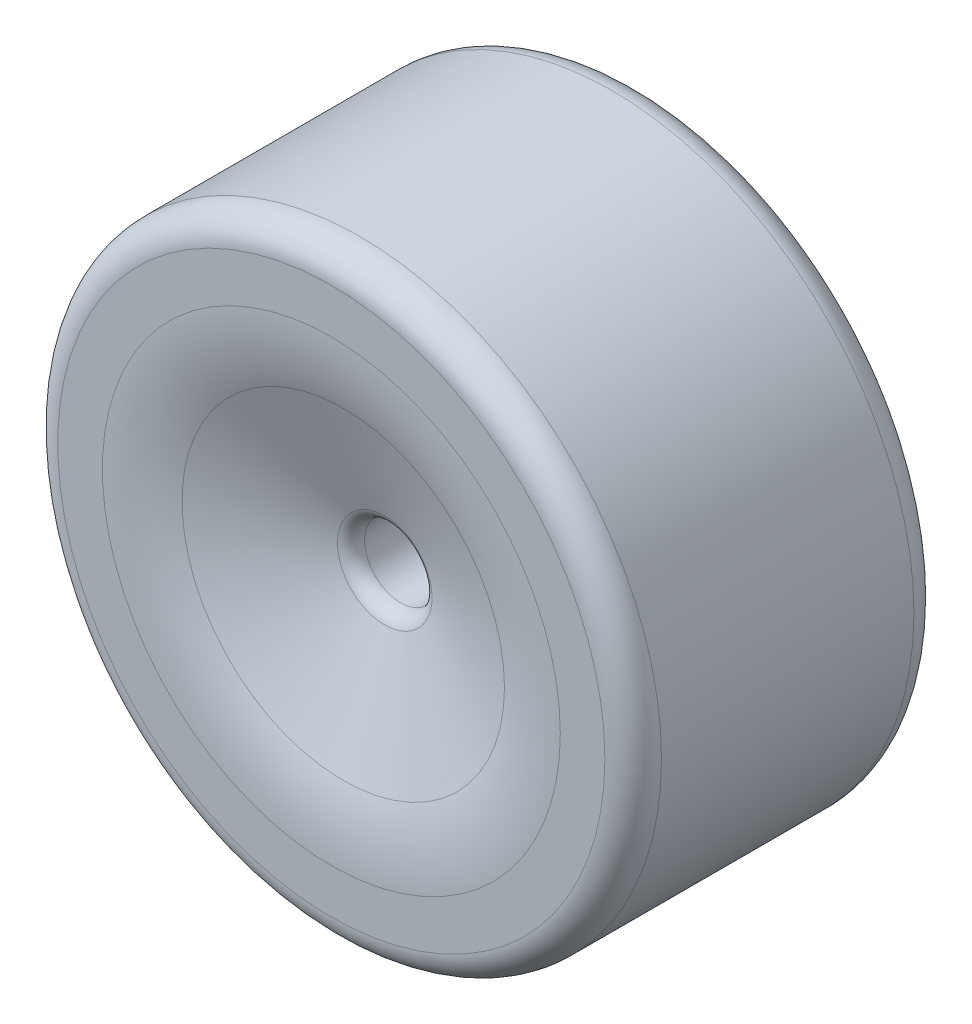
from build123d import *

# Parameters (mm, degrees)
SKETCH1_R          = 53.34
EXTRUDE1_DEPTH     = 54.61
FILLET1_R          = 5
SKETCH2_R          = 27.432
CUT_EXTRUDE1_DEPTH = 17.78
FILLET2_R          = 2
SKETCH3_R          = 34.29
CUT_EXTRUDE2_DEPTH = 10.16
CUT_EXTRUDE2_DRAFT = -70
FILLET3_R          = 35
SKETCH4_R          = 6.375629418
CUT_EXTRUDE3_DEPTH = 15.24
FILLET4_R          = 3


with BuildPart() as part:
    # Sketch1 → Extrude1 (new body)
    with BuildSketch(Plane.XY):
        Circle(SKETCH1_R)
    extrude(amount=EXTRUDE1_DEPTH)

    # Fillet1
    fillet1_edges = [part.edges().sort_by_distance(p)[0] for p in [
        (-53.34, 0, 0),
        (-53.34, 0, 54.61),
    ]]
    fillet(fillet1_edges, radius=FILLET1_R)

    # Sketch2 → Cut-Extrude1 (cut)
    with BuildSketch(Plane(origin=(0, 0, 0), x_dir=(-1, 0, 0), z_dir=(0, 0, -1))):
        Circle(SKETCH2_R)
    extrude(amount=-CUT_EXTRUDE1_DEPTH, mode=Mode.SUBTRACT)

    # Fillet2
    fillet2_edges = [part.edges().sort_by_distance(p)[0] for p in [
        (27.432, 0, 0),
    ]]
    fillet(fillet2_edges, radius=FILLET2_R)


with BuildPart() as cut_extrude2_tool:
    # Sketch3 → Cut-Extrude2 (with draft: the straight prism first)
    with BuildSketch(Plane.XY.offset(54.61)):
        Circle(SKETCH3_R)
    extrude(amount=-CUT_EXTRUDE2_DEPTH)
    # Cut-Extrude2: the draft: its side faces are tilted about the plane it starts from
    cut_extrude2_sides = [cut_extrude2_tool.faces().sort_by_distance(p)[0] for p in [
        (-34.29, 0, 49.53),
    ]]
    draft(cut_extrude2_sides, Plane.XY.offset(54.61), CUT_EXTRUDE2_DRAFT)


with BuildPart() as part_1:
    add(part.part)

    # Cut-Extrude2: cut by cut_extrude2_tool
    add(cut_extrude2_tool.part, mode=Mode.SUBTRACT)

    # Fillet3
    fillet3_edges = [part_1.edges().sort_by_distance(p)[0] for p in [
        (-34.29, 0, 54.61),
    ]]
    fillet(fillet3_edges, radius=FILLET3_R)

    # Sketch4 → Cut-Extrude3 (cut)
    with BuildSketch(Plane.XY.offset(44.45)):
        Circle(SKETCH4_R)
    extrude(amount=-CUT_EXTRUDE3_DEPTH, mode=Mode.SUBTRACT)

    # Fillet4
    fillet4_edges = [part_1.edges().sort_by_distance(p)[0] for p in [
        (-6.375629418, 0, 44.45),
    ]]
    fillet(fillet4_edges, radius=FILLET4_R)


solid = part_1.part
